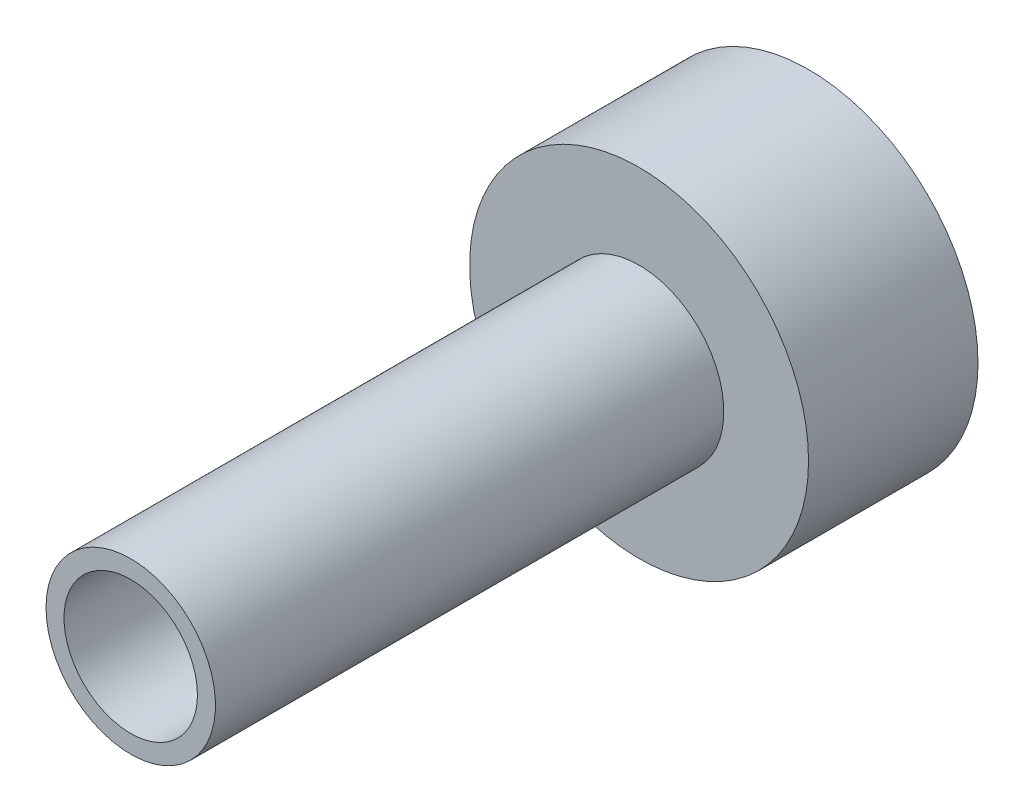
from build123d import *

# Parameters (mm, degrees)
SKETCH1_R                 = 6.35
SKETCH1_R_2               = 2.5
BOSS_EXTRUDE1_DEPTH       = 6.35
SKETCH2_R                 = 3.175
SKETCH2_R_2               = 2.5
BOSS_EXTRUDE2_DEPTH       = 19.05
F_4_40_TAPPED_HOLE1_D     = 2.2606
F_4_40_TAPPED_HOLE1_DEPTH = 6.349
F_4_40_TAPPED_HOLE1_TIP   = 0.679152758


with BuildPart() as part:
    # Sketch1 → Boss-Extrude1 (new body)
    with BuildSketch(Plane.XY):
        Circle(SKETCH1_R)
        Circle(SKETCH1_R_2, mode=Mode.SUBTRACT)
    extrude(amount=BOSS_EXTRUDE1_DEPTH)

    # Sketch2 → Boss-Extrude2 (add)
    with BuildSketch(Plane.XY.offset(6.35)):
        with Locations(Location((0, 0, 0), (0, 0, 180))):
            Circle(SKETCH2_R)
        Circle(SKETCH2_R_2, mode=Mode.SUBTRACT)
    extrude(amount=BOSS_EXTRUDE2_DEPTH)

    # #4-40 Tapped Hole1
    with Locations(Plane.ZY.offset(6.35)):
        with Locations((3.191608174, 0)):
            Hole(F_4_40_TAPPED_HOLE1_D / 2, depth=F_4_40_TAPPED_HOLE1_DEPTH)
            with Locations((0, 0, -(F_4_40_TAPPED_HOLE1_DEPTH + F_4_40_TAPPED_HOLE1_TIP / 2))):  # 118° drill point
                Cone(0, F_4_40_TAPPED_HOLE1_D / 2, F_4_40_TAPPED_HOLE1_TIP, mode=Mode.SUBTRACT)


solid = part.part
